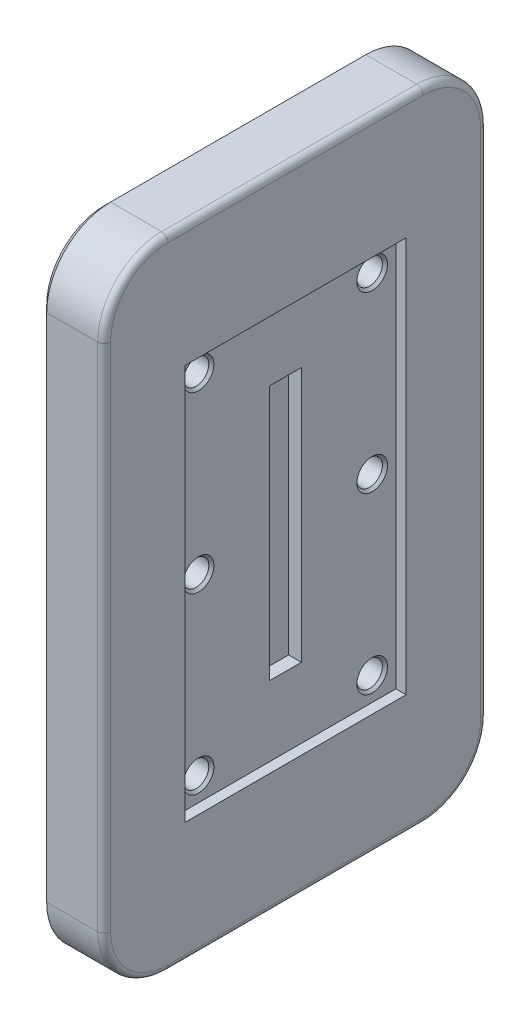
from build123d import *

# Parameters (mm, degrees)
SKETCH1_W           = 60
SKETCH1_H           = 100
BOSS_EXTRUDE1_DEPTH = 10
SKETCH2_W           = 34.6
SKETCH2_H           = 62
CUT_EXTRUDE1_DEPTH  = 1.6
SKETCH3_R           = 2
CUT_EXTRUDE2_DEPTH  = 59.911458987
FILLET1_R           = 10
FILLET2_R           = 1
CHAMFER1_SIZE       = 1
CHAMFER2_SIZE       = 0.4
SKETCH4_W           = 5
SKETCH4_H           = 40
CUT_EXTRUDE3_DEPTH  = 2


with BuildPart() as part:
    # Sketch1 → Boss-Extrude1 (new body)
    with BuildSketch(Plane(origin=(0, 0, 0), x_dir=(0, 0, -1), z_dir=(1, 0, 0))):
        Rectangle(SKETCH1_W, SKETCH1_H)
    extrude(amount=BOSS_EXTRUDE1_DEPTH)

    # Sketch2 → Cut-Extrude1 (cut)
    with BuildSketch(Plane(origin=(10, 0, 0), x_dir=(0, 0, -1), z_dir=(1, 0, 0))):
        Rectangle(SKETCH2_W, SKETCH2_H)
    extrude(amount=-CUT_EXTRUDE1_DEPTH, mode=Mode.SUBTRACT)

    # Sketch3 → Cut-Extrude2 (cut, through all)
    with BuildSketch(Plane(origin=(8.4, 0, 0), x_dir=(0, 0, -1), z_dir=(1, 0, 0))):
        with Locations((-13.6, 27.3)):
            Circle(SKETCH3_R)
        with Locations((13.6, 27.3)):
            Circle(SKETCH3_R)
        with Locations((-13.6, 0)):
            Circle(SKETCH3_R)
        with Locations((13.6, 0)):
            Circle(SKETCH3_R)
        with Locations((-13.6, -27.3)):
            Circle(SKETCH3_R)
        with Locations((13.6, -27.3)):
            Circle(SKETCH3_R)
    extrude(amount=-CUT_EXTRUDE2_DEPTH, mode=Mode.SUBTRACT)

    # Fillet1
    fillet1_edges = [part.edges().sort_by_distance(p)[0] for p in [
        (5, -50, -30),
        (5, -50, 30),
        (5, 50, 30),
        (5, 50, -30),
    ]]
    fillet(fillet1_edges, radius=FILLET1_R)

    # Fillet2
    fillet2_edges = [part.edges().sort_by_distance(p)[0] for p in [
        (10, -50, 0),
        (10, 0, 30),
        (10, 0, -30),
        (10, 50, 0),
        (10, -47.071067812, -27.071067812),
        (10, 47.071067812, -27.071067812),
        (10, 47.071067812, 27.071067812),
        (10, -47.071067812, 27.071067812),
    ]]
    fillet(fillet2_edges, radius=FILLET2_R)

    # Chamfer1
    chamfer1_edges = [part.edges().sort_by_distance(p)[0] for p in [
        (0, -27.3, 15.6),
        (0, 0, -11.6),
        (0, 0, 15.6),
        (0, 27.3, -11.6),
        (0, -27.3, -11.6),
        (0, 27.3, 15.6),
        (0, -50, 0),
        (0, 0, -30),
        (0, 0, 30),
        (0, 50, 0),
        (0, -47.071067812, -27.071067812),
        (0, 47.071067812, -27.071067812),
        (0, 47.071067812, 27.071067812),
        (0, -47.071067812, 27.071067812),
    ]]
    chamfer(chamfer1_edges, length=CHAMFER1_SIZE)

    # Chamfer2
    chamfer2_edges = [part.edges().sort_by_distance(p)[0] for p in [
        (8.4, -27.3, 15.6),
        (8.4, 0, -11.6),
        (8.4, 0, 15.6),
        (8.4, 27.3, -11.6),
        (8.4, -27.3, -11.6),
        (8.4, 27.3, 15.6),
    ]]
    chamfer(chamfer2_edges, length=CHAMFER2_SIZE)

    # Sketch4 → Cut-Extrude3 (cut)
    with BuildSketch(Plane(origin=(8.4, 0, 0), x_dir=(0, 0, -1), z_dir=(1, 0, 0))):
        Rectangle(SKETCH4_W, SKETCH4_H)
    extrude(amount=-CUT_EXTRUDE3_DEPTH, mode=Mode.SUBTRACT)


solid = part.part
